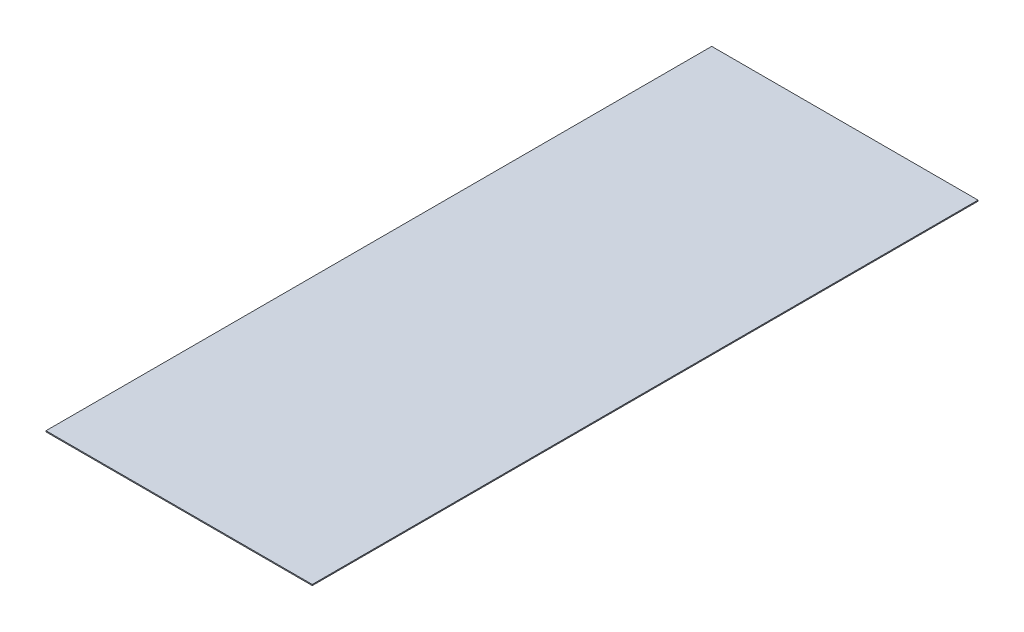
from build123d import *

# Parameters (mm, degrees)
CROQUIS1_W              = 1219.2
CROQUIS1_H              = 3048
SALIENTE_EXTRUIR1_DEPTH = 4.8


with BuildPart() as part:
    # Croquis1 → Saliente-Extruir1 (new body)
    with BuildSketch(Plane(origin=(0, 0, 0), x_dir=(1, 0, 0), z_dir=(0, 1, 0))):
        Rectangle(CROQUIS1_W, CROQUIS1_H)
    extrude(amount=SALIENTE_EXTRUIR1_DEPTH)


solid = part.part
